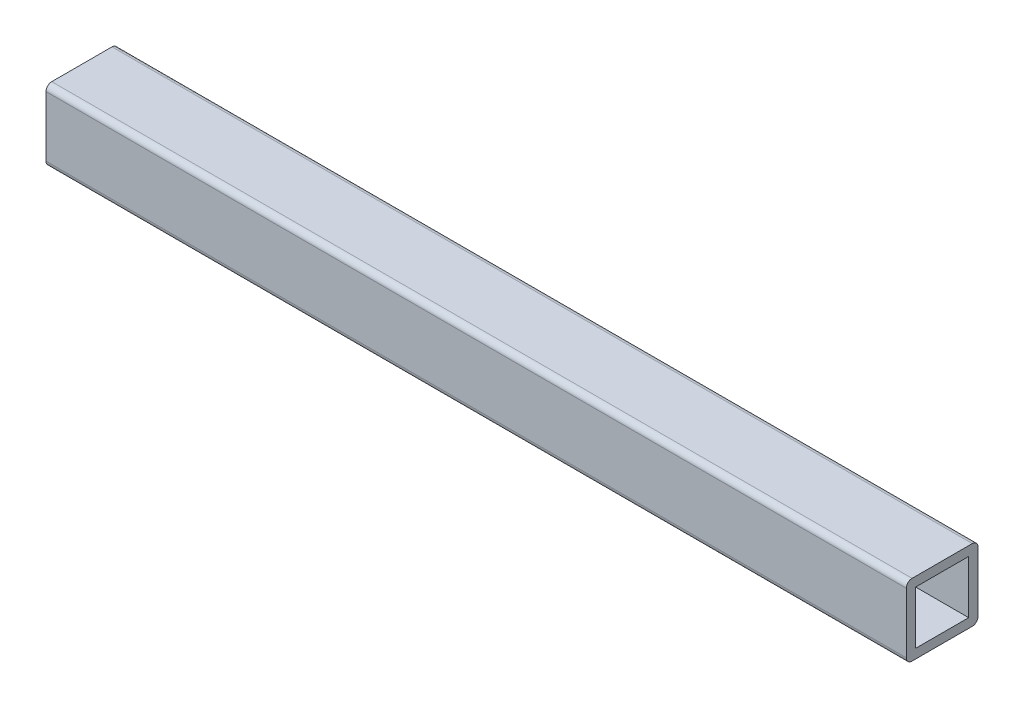
from build123d import *

# Parameters (mm, degrees)
SKETCH1_W           = 23.495
SKETCH1_H           = 23.495
BOSS_EXTRUDE1_DEPTH = 152.4
SCALE1_SCALE_X      = 1
SCALE1_SCALE_Y      = 0.4
SCALE1_SCALE_Z      = 0.4


with BuildPart() as part:
    # Sketch1 → Boss-Extrude1 (new body)
    with BuildSketch(Plane(origin=(0, 0, 0), x_dir=(0, 0, -1), z_dir=(1, 0, 0))):
        with BuildLine():
            Line((0, 2.54), (0, 29.21))
            ThreePointArc((0, 29.21), (-0.743948776, 31.006051224), (-2.54, 31.75))
            Line((-2.54, 31.75), (-29.21, 31.75))
            ThreePointArc((-29.21, 31.75), (-31.006051224, 31.006051224), (-31.75, 29.21))
            Line((-31.75, 29.21), (-31.75, 2.54))
            ThreePointArc((-31.75, 2.54), (-31.006051224, 0.743948776), (-29.21, 0))
            Line((-29.21, 0), (-2.54, 0))
            ThreePointArc((-2.54, 0), (-0.743948776, 0.743948776), (0, 2.54))
        make_face()
        with Locations((-15.875, 15.875)):
            Rectangle(SKETCH1_W, SKETCH1_H, mode=Mode.SUBTRACT)
    extrude(amount=BOSS_EXTRUDE1_DEPTH)


with BuildPart() as part_1:
    # Scale1: scaled about (76.2, 15.875, 15.875)
    add(part.part.scale((SCALE1_SCALE_X, SCALE1_SCALE_Y, SCALE1_SCALE_Z), about=(76.2, 15.875, 15.875)))


solid = part_1.part
